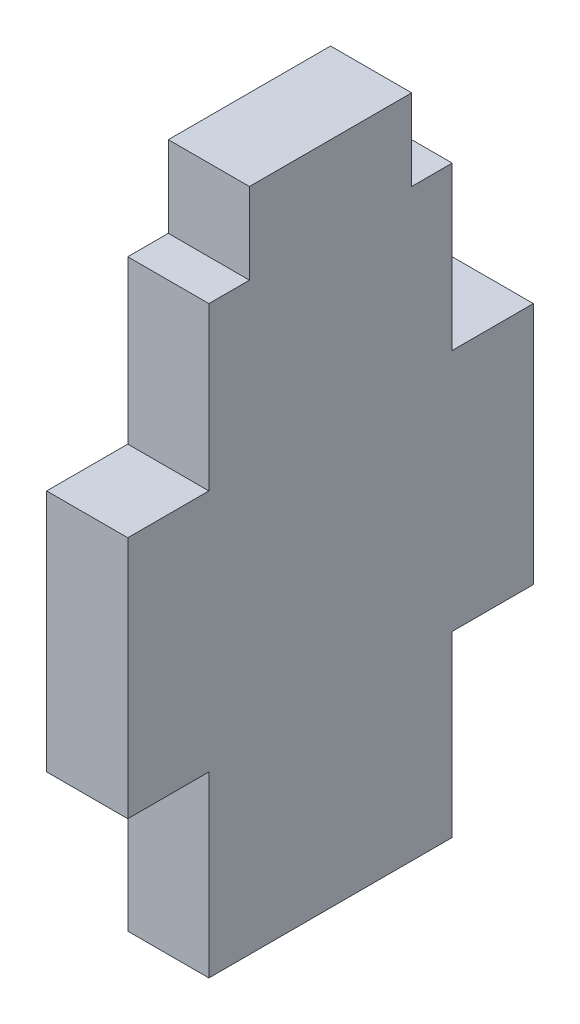
from build123d import *

# Parameters (mm, degrees)
EXTRUDE_1_DEPTH = 5


with BuildPart() as part:
    # 草图1 → 凸台-拉伸1 (new body)
    with BuildSketch(Plane(origin=(0, 0, 0), x_dir=(0, 0, -1), z_dir=(1, 0, 0))):
        Polygon((-12.5, 36), (-15, 36), (-15, 26), (-20, 26), (-20, 11), (-15, 11), (-15, 0), (0, 0), (0, 11), (5, 11), (5, 26), (0, 26), (0, 36), (-2.5, 36), (-2.5, 41), (-12.5, 41), align=None)
    extrude(amount=EXTRUDE_1_DEPTH)


solid = part.part
